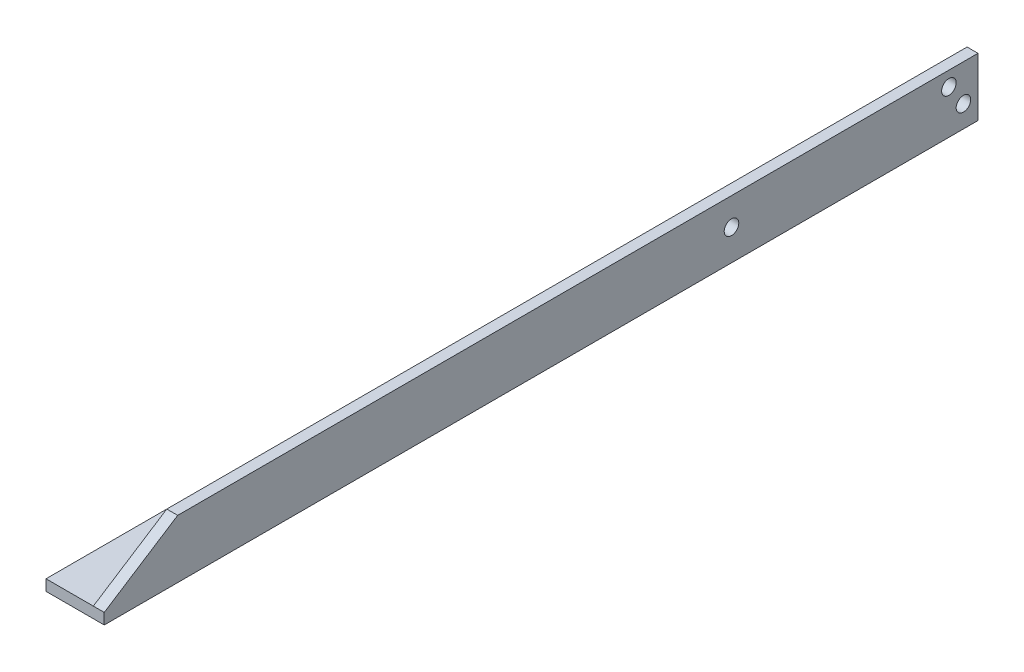
from build123d import *

# Parameters (mm, degrees)
BOSS_EXTRUDE1_DEPTH     = 381
CUT_EXTRUDE3_DEPTH      = 383.403015687
CUT_EXTRUDE3_DEPTH_BACK = 383.403015687
CUT_EXTRUDE4_REACH      = 384.403
SKETCH6_R               = 3.175
CUT_EXTRUDE5_REACH      = 384.69
SKETCH7_R               = 3.175
CUT_EXTRUDE6_REACH      = 384.403
SKETCH8_R               = 3.175


with BuildPart() as part:
    # Sketch1 → Boss-Extrude1 (new body)
    with BuildSketch(Plane.XY):
        Polygon((0, 0), (0, -25.4), (-25.4, -25.4), (-25.4, -20.6375), (-4.7625, -20.6375), (-4.7625, 0), align=None)
    extrude(amount=BOSS_EXTRUDE1_DEPTH)

    # Sketch4 → Cut-Extrude3 (cut, two sides: drawn at the far end of the back side and taken through both)
    with BuildSketch(Plane.ZY.offset(4.7625).offset(-CUT_EXTRUDE3_DEPTH_BACK)):
        Polygon((1030.877066877, -439.409233154), (381, -20.6375), (348.97339241, 0), (-300.903674467, 418.771733154), (536.63979184, 1718.525866908), (1868.420533185, 860.3449006), align=None)
    extrude(amount=CUT_EXTRUDE3_DEPTH + CUT_EXTRUDE3_DEPTH_BACK, mode=Mode.SUBTRACT)

    # Sketch6 → Cut-Extrude4 (cut, up to next)
    with BuildSketch(Plane.ZY.offset(4.7625), mode=Mode.PRIVATE) as cut_extrude4_sk1:
        with Locations((6.35, -15.875)):
            Circle(SKETCH6_R)
    cut_extrude4_tool1 = extrude(cut_extrude4_sk1.sketch, amount=-CUT_EXTRUDE4_REACH, mode=Mode.PRIVATE) & part.part
    # Sketch6 → Cut-Extrude4 (cut, up to next)
    with BuildSketch(Plane.ZY.offset(4.7625), mode=Mode.PRIVATE) as cut_extrude4_sk2:
        with Locations((12.7, -6.35)):
            Circle(SKETCH6_R)
    cut_extrude4_tool2 = extrude(cut_extrude4_sk2.sketch, amount=-CUT_EXTRUDE4_REACH, mode=Mode.PRIVATE) & part.part
    add(cut_extrude4_tool1.solids().sort_by_distance((-4.7625, -15.875, 6.35))[0], mode=Mode.SUBTRACT)
    add(cut_extrude4_tool2.solids().sort_by_distance((-4.7625, -6.35, 12.7))[0], mode=Mode.SUBTRACT)

    # Sketch7 → Cut-Extrude5 (cut, up to next)
    with BuildSketch(Plane(origin=(0, 0, 0), x_dir=(0, 0, -1), z_dir=(1, 0, 0)), mode=Mode.PRIVATE) as cut_extrude5_sk1:
        with Locations(Location((-107.490701513, -11.929615818, 0), (0, 0, 90))):
            Circle(SKETCH7_R)
    cut_extrude5_tool1 = extrude(cut_extrude5_sk1.sketch, amount=-CUT_EXTRUDE5_REACH, mode=Mode.PRIVATE) & part.part
    add(cut_extrude5_tool1.solids().sort_by_distance((0, -11.929616, 107.490702))[0], mode=Mode.SUBTRACT)

    # Sketch8 → Cut-Extrude6 (cut, up to next)
    with BuildSketch(Plane(origin=(0, -20.6375, 0), x_dir=(1, 0, 0), z_dir=(0, 1, 0)), mode=Mode.PRIVATE) as cut_extrude6_sk1:
        with Locations(Location((-15.08125, -12.7, 0), (0, 0, 180))):
            Circle(SKETCH8_R)
    cut_extrude6_tool1 = extrude(cut_extrude6_sk1.sketch, amount=-CUT_EXTRUDE6_REACH, mode=Mode.PRIVATE) & part.part
    add(cut_extrude6_tool1.solids().sort_by_distance((-15.08125, -20.6375, 12.7))[0], mode=Mode.SUBTRACT)


solid = part.part
